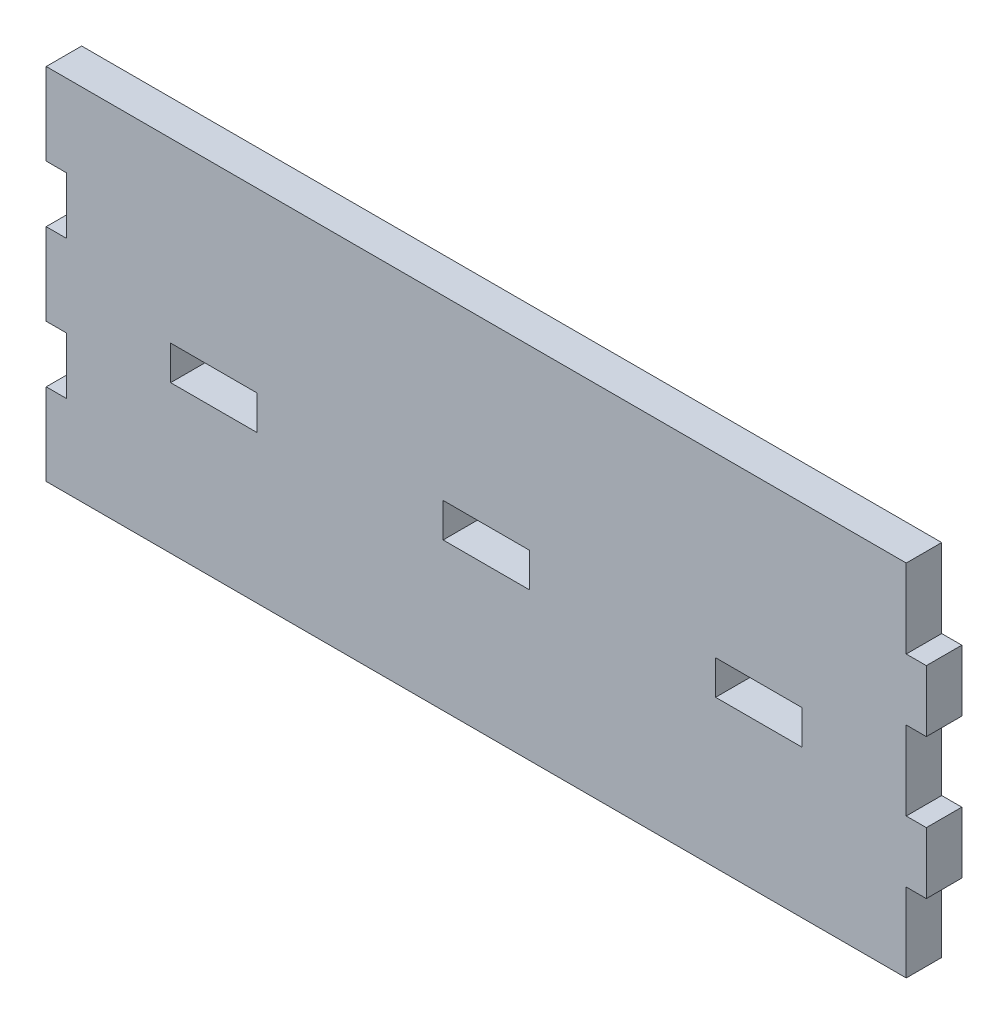
from build123d import *

# Parameters (mm, degrees)
SKETCH_1_W      = 14.6
SKETCH_1_H      = 5.8
EXTRUDE_1_DEPTH = 6


with BuildPart() as part:
    # Эскиз1 → Бобышка-Вытянуть1 (new body)
    with BuildSketch(Plane.XY):
        Polygon((-71.05, -30.4), (71.05, -30.4), (71.05, -17.066666667), (74.45, -17.066666667), (74.45, -6.666666667), (71.05, -6.666666667), (71.05, 6.666666667), (74.45, 6.666666667), (74.45, 17.066666667), (71.05, 17.066666667), (71.05, 30.4), (-71.05, 30.4), (-74.45, 30.4), (-74.45, 16.533333333), (-71.05, 16.533333333), (-71.05, 6.933333333), (-74.45, 6.933333333), (-74.45, -6.933333333), (-71.05, -6.933333333), (-71.05, -16.533333333), (-74.45, -16.533333333), (-74.45, -30.4), align=None)
        with Locations((0, -2.5)):
            Rectangle(SKETCH_1_W, SKETCH_1_H, mode=Mode.SUBTRACT)
        with Locations((-46.1, -2.5)):
            Rectangle(SKETCH_1_W, SKETCH_1_H, mode=Mode.SUBTRACT)
        with Locations((46.1, -2.5)):
            Rectangle(SKETCH_1_W, SKETCH_1_H, mode=Mode.SUBTRACT)
    extrude(amount=EXTRUDE_1_DEPTH)


solid = part.part
